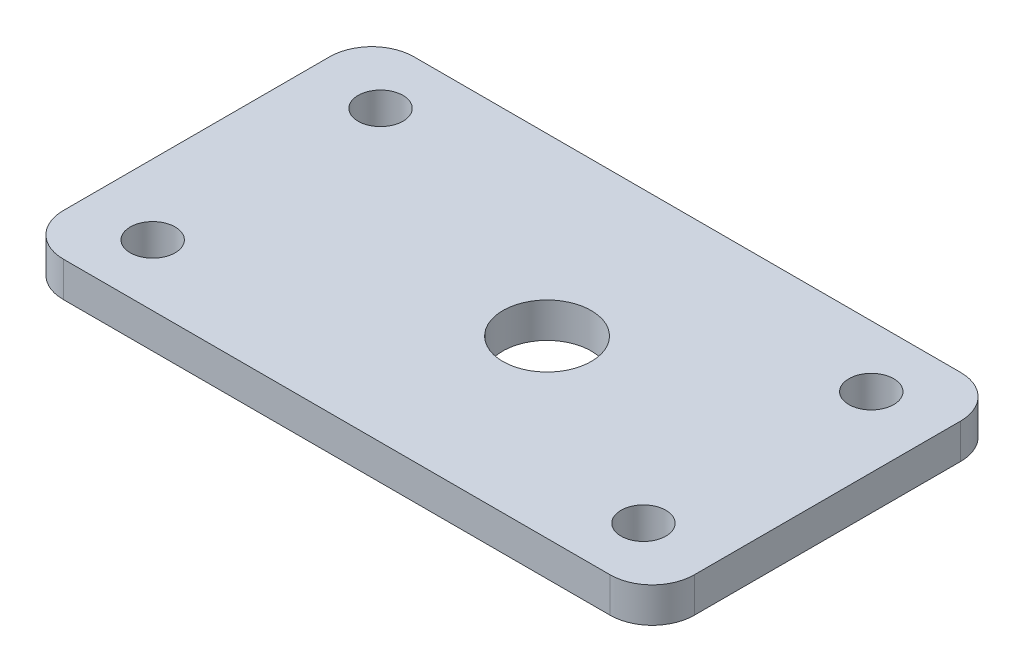
from build123d import *

# Parameters (mm, degrees)
SKETCH1_W           = 57.15
SKETCH1_H           = 31.75
SKETCH1_R           = 4
BOSS_EXTRUDE1_DEPTH = 3.175
FILLET1_R           = 3.81
SKETCH2_R           = 2.032
CUT_EXTRUDE1_DEPTH  = 33.842455374


with BuildPart() as part:
    # Sketch1 → Boss-Extrude1 (new body)
    with BuildSketch(Plane(origin=(0, 0, 0), x_dir=(1, 0, 0), z_dir=(0, 1, 0))):
        Rectangle(SKETCH1_W, SKETCH1_H)
        with Locations(Location((3.175, 0, 0), (0, 0, 270))):
            Circle(SKETCH1_R, mode=Mode.SUBTRACT)
    extrude(amount=BOSS_EXTRUDE1_DEPTH)

    # Fillet1
    fillet1_edges = [part.edges().sort_by_distance(p)[0] for p in [
        (28.575, 1.5875, 15.875),
        (-28.575, 1.5875, 15.875),
        (-28.575, 1.5875, -15.875),
        (28.575, 1.5875, -15.875),
    ]]
    fillet(fillet1_edges, radius=FILLET1_R)

    # Sketch2 → Cut-Extrude1 (cut, through all)
    with BuildSketch(Plane.XZ):
        with Locations(Location((22.225, -10.31875, 0), (0, 0, 270))):
            Circle(SKETCH2_R)
        with Locations(Location((22.225, 10.31875, 0), (0, 0, 270))):
            Circle(SKETCH2_R)
        with Locations(Location((-22.225, -10.31875, 0), (0, 0, 270))):
            Circle(SKETCH2_R)
        with Locations(Location((-22.225, 10.31875, 0), (0, 0, 270))):
            Circle(SKETCH2_R)
    extrude(amount=-CUT_EXTRUDE1_DEPTH, mode=Mode.SUBTRACT)


solid = part.part
